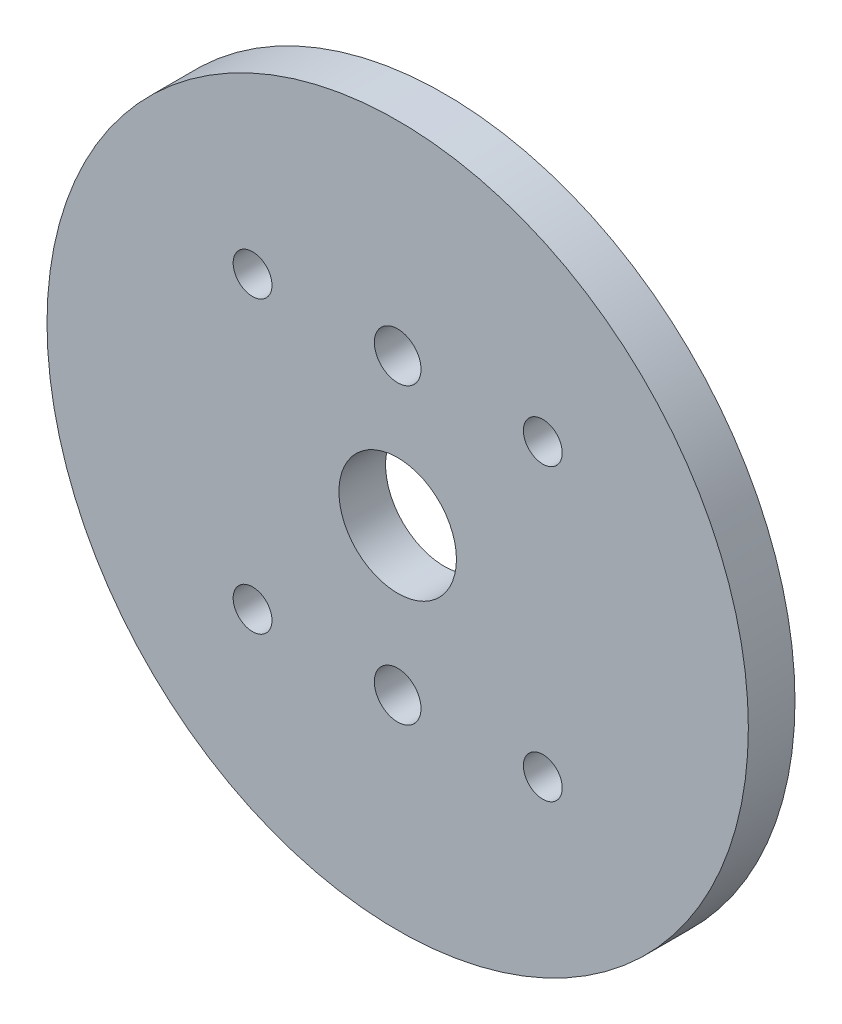
from build123d import *

# Parameters (mm, degrees)
SKETCH1_R           = 23.87
SKETCH1_R_2         = 1.5875
SKETCH1_R_3         = 1.3208
SKETCH1_R_4         = 4
BOSS_EXTRUDE2_DEPTH = 3.175


with BuildPart() as part:
    # Sketch1 → Boss-Extrude2 (new body)
    with BuildSketch(Plane.XY):
        Circle(SKETCH1_R)
        with Locations((0, 10)):
            Circle(SKETCH1_R_2, mode=Mode.SUBTRACT)
        with Locations((9.878281733, -9.878281733)):
            Circle(SKETCH1_R_3, mode=Mode.SUBTRACT)
        with Locations((9.878281733, 9.878281733)):
            Circle(SKETCH1_R_3, mode=Mode.SUBTRACT)
        with Locations((-9.878281733, -9.878281733)):
            Circle(SKETCH1_R_3, mode=Mode.SUBTRACT)
        with Locations((-9.878281733, 9.878281733)):
            Circle(SKETCH1_R_3, mode=Mode.SUBTRACT)
        Circle(SKETCH1_R_4, mode=Mode.SUBTRACT)
        with Locations((0, -10)):
            Circle(SKETCH1_R_2, mode=Mode.SUBTRACT)
    extrude(amount=BOSS_EXTRUDE2_DEPTH)


solid = part.part
